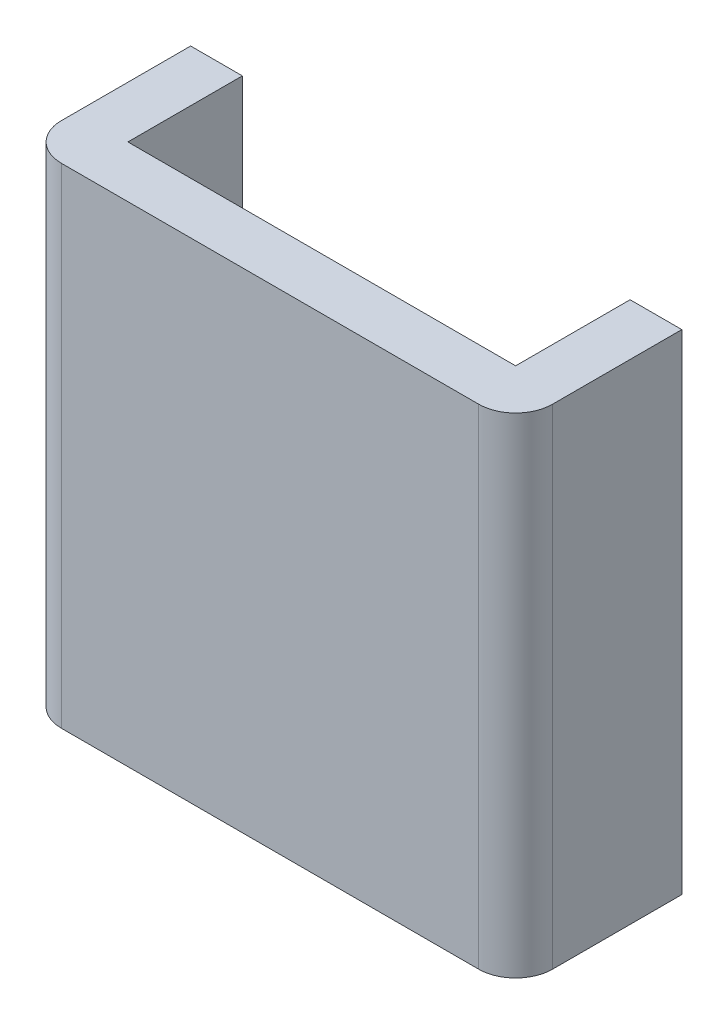
from build123d import *

# Parameters (mm, degrees)
BOSS_EXTRU_1_DEPTH = 26.5
CONG_1_R           = 2


with BuildPart() as part:
    # Esquisse1 → Boss.-Extru.1 (new body)
    with BuildSketch(Plane(origin=(0, 0, 0), x_dir=(1, 0, 0), z_dir=(0, 1, 0))):
        Polygon((-13.3, 0), (13.3, 0), (13.3, 9), (10.5, 9), (10.5, 2.8), (-10.5, 2.8), (-10.5, 9), (-13.3, 9), align=None)
    extrude(amount=BOSS_EXTRU_1_DEPTH)

    # Congé1
    cong_1_edges = [part.edges().sort_by_distance(p)[0] for p in [
        (13.3, 13.25, 0),
        (-13.3, 13.25, 0),
    ]]
    fillet(cong_1_edges, radius=CONG_1_R)


solid = part.part
